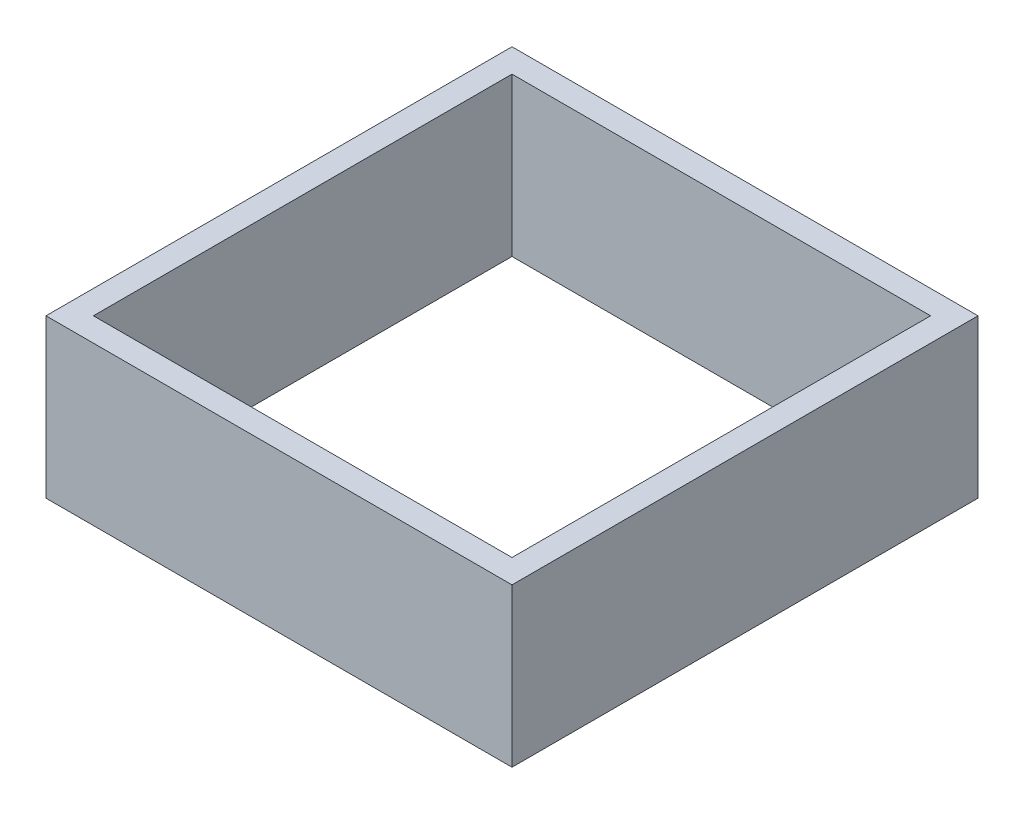
from build123d import *

# Parameters (mm, degrees)
SKETCH1_W           = 59
SKETCH1_H           = 59
SKETCH1_W_2         = 53
SKETCH1_H_2         = 53
BOSS_EXTRUDE1_DEPTH = 20


with BuildPart() as part:
    # Sketch1 → Boss-Extrude1 (new body)
    with BuildSketch(Plane(origin=(0, 0, 0), x_dir=(1, 0, 0), z_dir=(0, 1, 0))):
        Rectangle(SKETCH1_W, SKETCH1_H)
        Rectangle(SKETCH1_W_2, SKETCH1_H_2, mode=Mode.SUBTRACT)
    extrude(amount=BOSS_EXTRUDE1_DEPTH)


solid = part.part
